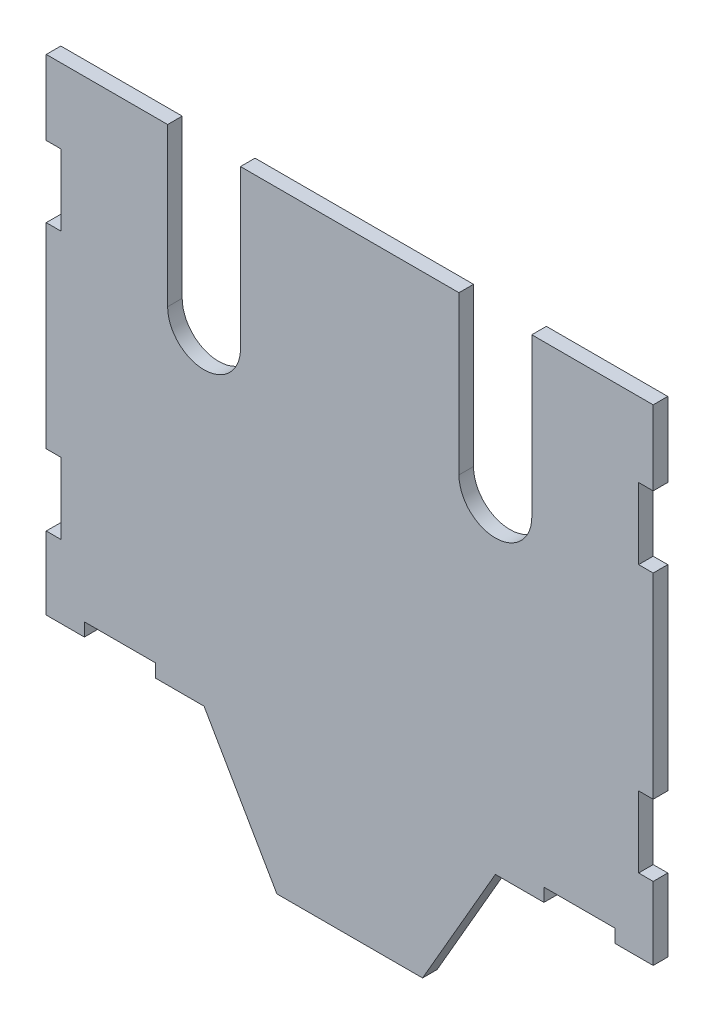
from build123d import *

# Parameters (mm, degrees)
EXTRUDE_1_DEPTH = 6


with BuildPart() as part:
    # Эскиз1 → Бобышка-Вытянуть1 (new body)
    with BuildSketch(Plane.XY):
        with BuildLine():
            Line((0, 0), (-50, 0))
            Line((-50, 0), (-50, -65))
            ThreePointArc((-50, -65), (-65, -80), (-80, -65))
            Line((-80, -65), (-80, 0))
            Line((-80, 0), (-170, 0))
            Line((-170, 0), (-170, -65))
            ThreePointArc((-170, -65), (-185, -80), (-200, -65))
            Line((-200, -65), (-200, 0))
            Line((-200, 0), (-250, 0))
            Line((-250, 0), (-250, -30.7))
            Line((-250, -30.7), (-244, -30.7))
            Line((-244, -30.7), (-244, -60))
            Line((-244, -60), (-250, -60))
            Line((-250, -60), (-250, -140.7))
            Line((-250, -140.7), (-244, -140.7))
            Line((-244, -140.7), (-244, -170))
            Line((-244, -170), (-250, -170))
            Line((-250, -170), (-250, -200))
            Line((-250, -200), (-234.3, -200))
            Line((-234.3, -200), (-234.3, -194.55))
            Line((-234.3, -194.55), (-205, -194.55))
            Line((-205, -194.55), (-205, -200))
            Line((-205, -200), (-185, -200))
            Line((-185, -200), (-155, -251.961524227))
            Line((-155, -251.961524227), (-95, -251.961524227))
            Line((-95, -251.961524227), (-65, -200))
            Line((-65, -200), (-45, -200))
            Line((-45, -200), (-45, -194.55))
            Line((-45, -194.55), (-15.7, -194.55))
            Line((-15.7, -194.55), (-15.7, -200))
            Line((-15.7, -200), (0, -200))
            Line((0, -200), (0, -170))
            Line((0, -170), (-6, -170))
            Line((-6, -170), (-6, -140.7))
            Line((-6, -140.7), (0, -140.7))
            Line((0, -140.7), (0, -60))
            Line((0, -60), (-6, -60))
            Line((-6, -60), (-6, -30.7))
            Line((-6, -30.7), (0, -30.7))
            Line((0, -30.7), (0, 0))
        make_face()
    extrude(amount=EXTRUDE_1_DEPTH)


solid = part.part
